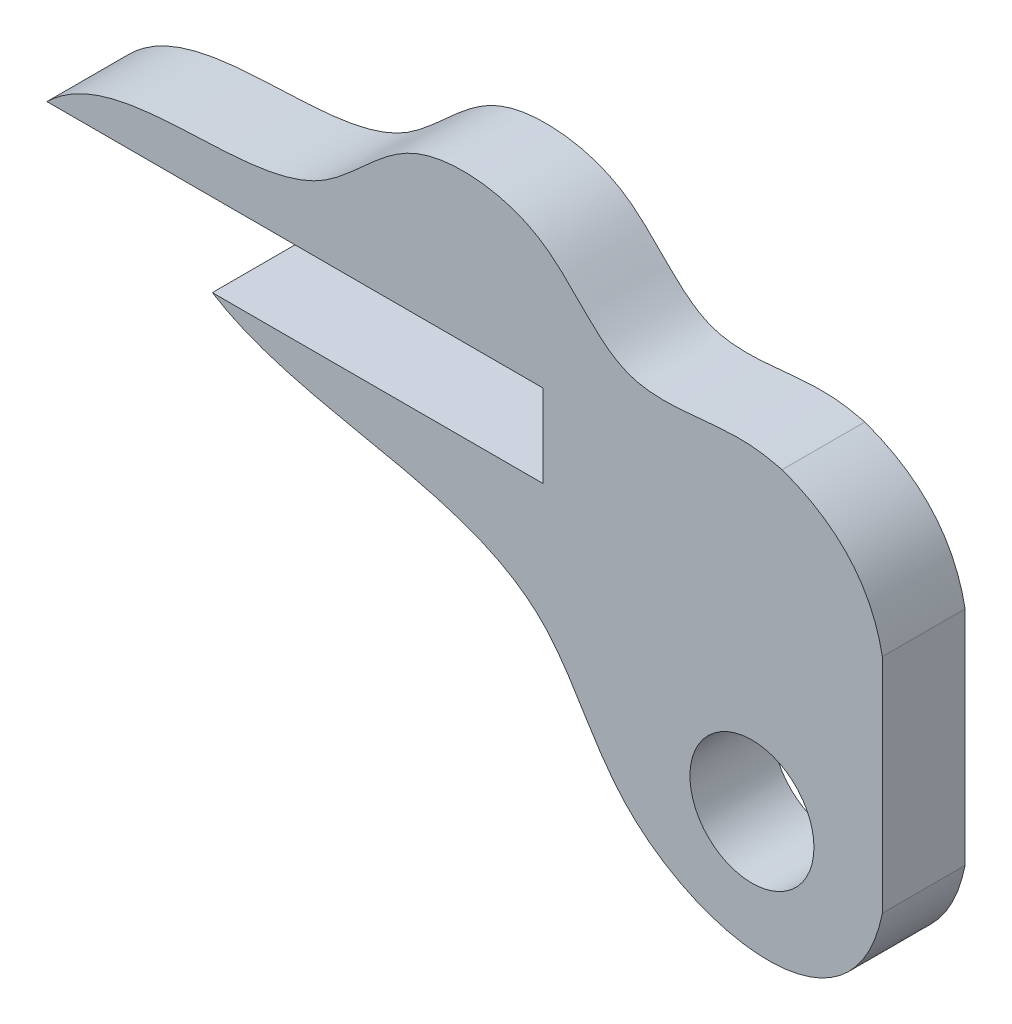
from build123d import *

# Parameters (mm, degrees)
SKETCH1_R           = 2.38125
BOSS_EXTRUDE1_DEPTH = 3.175
CUT_EXTRUDE1_DEPTH  = 41.943448555


with BuildPart() as part:
    # Sketch1 → Boss-Extrude1 (new body)
    with BuildSketch(Plane.XY):
        with BuildLine():
            Line((-7.9375, 27.235546875), (11.1125, 27.235546875))
            Line((11.1125, 27.235546875), (11.1125, 24.060546875))
            Line((11.1125, 24.060546875), (-1.5875, 24.060546875))
            add(Edge.make_bspline(
                [(-1.5875, 24.060546875), (2.018825623, 21.799419545), (10.633002779, 22.702913031), (14.444449363, 12.395288116), (23.070537685, 11.025750537), (24.136484021, 16.291183817)],
                knots=[0, 0, 0, 0, 0.438351695, 0.615086988, 1, 1, 1, 1], degree=3))
            Line((24.136484021, 16.291183817), (24.136484021, 28.431274529))
            add(Edge.make_bspline(
                [(-7.9375, 27.235546875), (-5.138848496, 29.986604457), (1.482017793, 27.321515058), (5.396027486, 32.794490027), (8.77853623, 33.057647792), (11.779327256, 32.034629922), (14.10742643, 28.280525974), (19.416746163, 30.094957124), (22.364415365, 28.20701954), (24.136484021, 28.431274529)],
                knots=[0, 0, 0, 0, 0.316709121, 0.442153112, 0.523486204, 0.592442824, 0.712295484, 0.852347032, 1, 1, 1, 1], degree=3))
        make_face()
        with Locations((19.128076736, 17.164397364)):
            Circle(SKETCH1_R, mode=Mode.SUBTRACT)
    extrude(amount=BOSS_EXTRUDE1_DEPTH)

    # Sketch2 → Cut-Extrude1 (cut, through all)
    with BuildSketch(Plane.XY.offset(3.175)):
        with BuildLine():
            Line((20.289143392, 29.109894753), (24.692953489, 31.442360813))
            Line((24.692953489, 31.442360813), (27.797759172, 27.509606949))
            Line((27.797759172, 27.509606949), (24.136484021, 24.818775358))
            add(Edge.make_bspline(
                [(24.136484021, 24.818775358), (23.545622288, 27.931703018), (20.289143392, 29.109894753)],
                knots=[0, 0, 0, 1, 1, 1], degree=2))
        make_face()
    extrude(amount=-CUT_EXTRUDE1_DEPTH, mode=Mode.SUBTRACT)


solid = part.part
